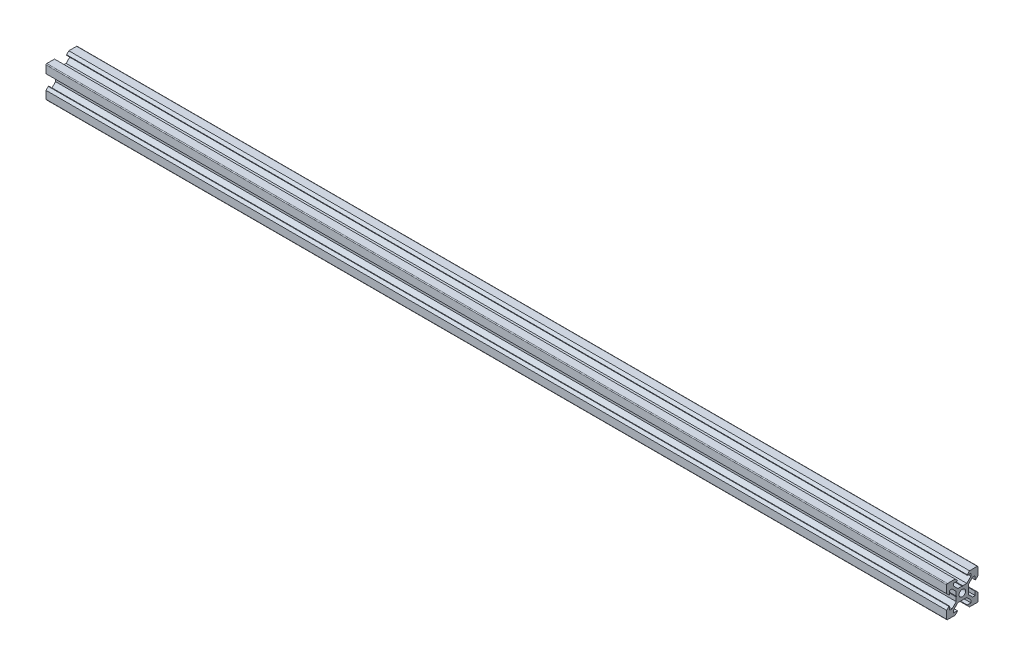
from build123d import *

# Parameters (mm, degrees)
PROFILE_SKETCH_R      = 2.1
PROFILE_EXTRUDE_DEPTH = 575


with BuildPart() as part:
    # Profile Sketch → Profile Extrude (new body)
    with BuildSketch(Plane(origin=(0, 0, 0), x_dir=(0, 0, -1), z_dir=(1, 0, 0))):
        with BuildLine():
            ThreePointArc((0, 9.5), (-0.146446609, 9.853553391), (-0.5, 10))
            Line((-0.5, 10), (-5.42, 10))
            Line((-5.42, 10), (-6.875, 8.545))
            Line((-6.875, 8.545), (-6.875, 8.2))
            Line((-6.875, 8.2), (-4.5, 8.2))
            Line((-4.5, 8.2), (-4.5, 6.56))
            Line((-4.5, 6.56), (-7.16, 3.9))
            Line((-7.16, 3.9), (-9.79, 3.9))
            Line((-9.79, 3.9), (-10, 3.69))
            Line((-10, 3.69), (-10.21, 3.9))
            Line((-10.21, 3.9), (-12.84, 3.9))
            Line((-12.84, 3.9), (-15.5, 6.56))
            Line((-15.5, 6.56), (-15.5, 8.2))
            Line((-15.5, 8.2), (-13.125, 8.2))
            Line((-13.125, 8.2), (-13.125, 8.545))
            Line((-13.125, 8.545), (-14.58, 10))
            Line((-14.58, 10), (-19.5, 10))
            ThreePointArc((-19.5, 10), (-19.853553391, 9.853553391), (-20, 9.5))
            Line((-20, 9.5), (-20, 4.58))
            Line((-20, 4.58), (-18.545, 3.125))
            Line((-18.545, 3.125), (-18.2, 3.125))
            Line((-18.2, 3.125), (-18.2, 5.5))
            Line((-18.2, 5.5), (-16.56, 5.5))
            Line((-16.56, 5.5), (-13.9, 2.838679656))
            Line((-13.9, 2.838679656), (-13.9, 0.21))
            Line((-13.9, 0.21), (-13.69, 0))
            Line((-13.69, 0), (-13.9, -0.21))
            Line((-13.9, -0.21), (-13.9, -2.838679656))
            Line((-13.9, -2.838679656), (-16.56, -5.5))
            Line((-16.56, -5.5), (-18.2, -5.5))
            Line((-18.2, -5.5), (-18.2, -3.125))
            Line((-18.2, -3.125), (-18.545, -3.125))
            Line((-18.545, -3.125), (-20, -4.58))
            Line((-20, -4.58), (-20, -9.5))
            ThreePointArc((-20, -9.5), (-19.853553391, -9.853553391), (-19.5, -10))
            Line((-19.5, -10), (-14.58, -10))
            Line((-14.58, -10), (-13.125, -8.545))
            Line((-13.125, -8.545), (-13.125, -8.2))
            Line((-13.125, -8.2), (-15.5, -8.2))
            Line((-15.5, -8.2), (-15.5, -6.56))
            Line((-15.5, -6.56), (-12.84, -3.9))
            Line((-12.84, -3.9), (-10.21, -3.9))
            Line((-10.21, -3.9), (-10, -3.69))
            Line((-10, -3.69), (-9.79, -3.9))
            Line((-9.79, -3.9), (-7.16, -3.9))
            Line((-7.16, -3.9), (-4.5, -6.56))
            Line((-4.5, -6.56), (-4.5, -8.2))
            Line((-4.5, -8.2), (-6.875, -8.2))
            Line((-6.875, -8.2), (-6.875, -8.545))
            Line((-6.875, -8.545), (-5.42, -10))
            Line((-5.42, -10), (-0.5, -10))
            ThreePointArc((-0.5, -10), (-0.146446609, -9.853553391), (0, -9.5))
            Line((0, -9.5), (0, -4.58))
            Line((0, -4.58), (-1.455, -3.125))
            Line((-1.455, -3.125), (-1.8, -3.125))
            Line((-1.8, -3.125), (-1.8, -5.5))
            Line((-1.8, -5.5), (-3.44, -5.5))
            Line((-3.44, -5.5), (-6.1, -2.838679656))
            Line((-6.1, -2.838679656), (-6.1, -0.21))
            Line((-6.1, -0.21), (-6.1, 2.838679656))
            Line((-6.1, 2.838679656), (-3.438679656, 5.5))
            Line((-3.438679656, 5.5), (-1.8, 5.5))
            Line((-1.8, 5.5), (-1.8, 3.125))
            Line((-1.8, 3.125), (-1.455, 3.125))
            Line((-1.455, 3.125), (0, 4.58))
            Line((0, 4.58), (0, 9.5))
        make_face()
        with Locations((-10, 0)):
            Circle(PROFILE_SKETCH_R, mode=Mode.SUBTRACT)
    extrude(amount=PROFILE_EXTRUDE_DEPTH)


solid = part.part
